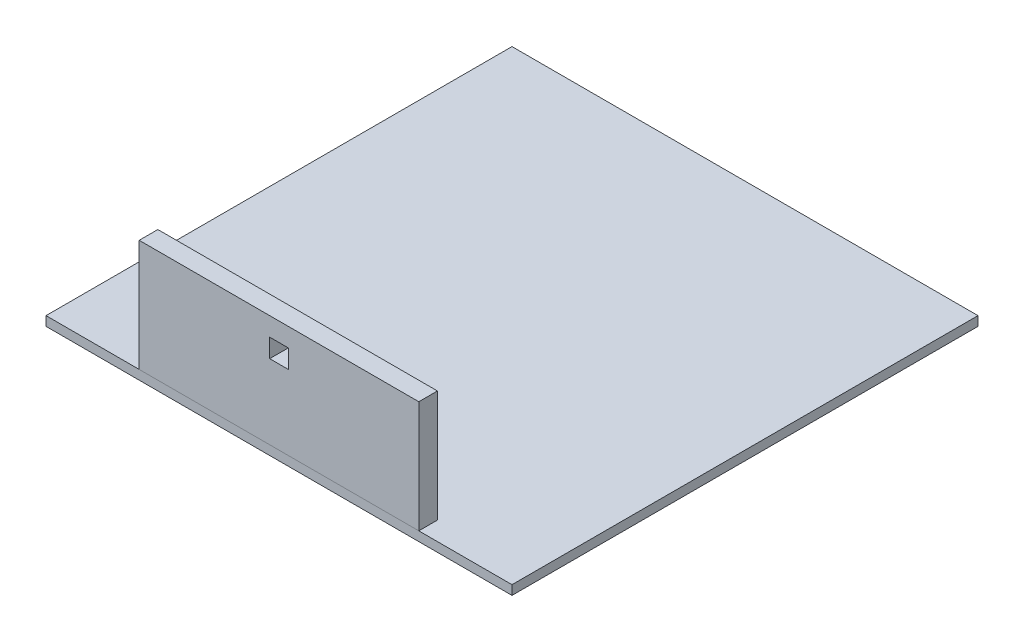
from build123d import *

# Parameters (mm, degrees)
SKETCH1_W           = 500
SKETCH1_H           = 500
BOSS_EXTRUDE1_DEPTH = 10
SKETCH5_W           = 300
SKETCH5_H           = 20
BOSS_EXTRUDE4_DEPTH = 120
SKETCH7_W           = 20
SKETCH7_H           = 20
CUT_EXTRUDE1_DEPTH  = 574.933794091


with BuildPart() as part:
    # Sketch1 → Boss-Extrude1 (new body)
    with BuildSketch(Plane(origin=(0, 0, 0), x_dir=(1, 0, 0), z_dir=(0, 1, 0))):
        Rectangle(SKETCH1_W, SKETCH1_H)
    extrude(amount=BOSS_EXTRUDE1_DEPTH)


with BuildPart() as body_2:
    # Sketch5 → Boss-Extrude4 (new body)
    with BuildSketch(Plane(origin=(0, 10, 0), x_dir=(1, 0, 0), z_dir=(0, 1, 0))):
        with Locations((0, -240)):
            Rectangle(SKETCH5_W, SKETCH5_H)
    extrude(amount=BOSS_EXTRUDE4_DEPTH)

    # Sketch7 → Cut-Extrude1 (cut, through all)
    with BuildSketch(Plane.XY.offset(250)):
        with Locations((0, 100)):
            Rectangle(SKETCH7_W, SKETCH7_H)
    extrude(amount=-CUT_EXTRUDE1_DEPTH, mode=Mode.SUBTRACT)


solid = Compound([part.part, body_2.part])
